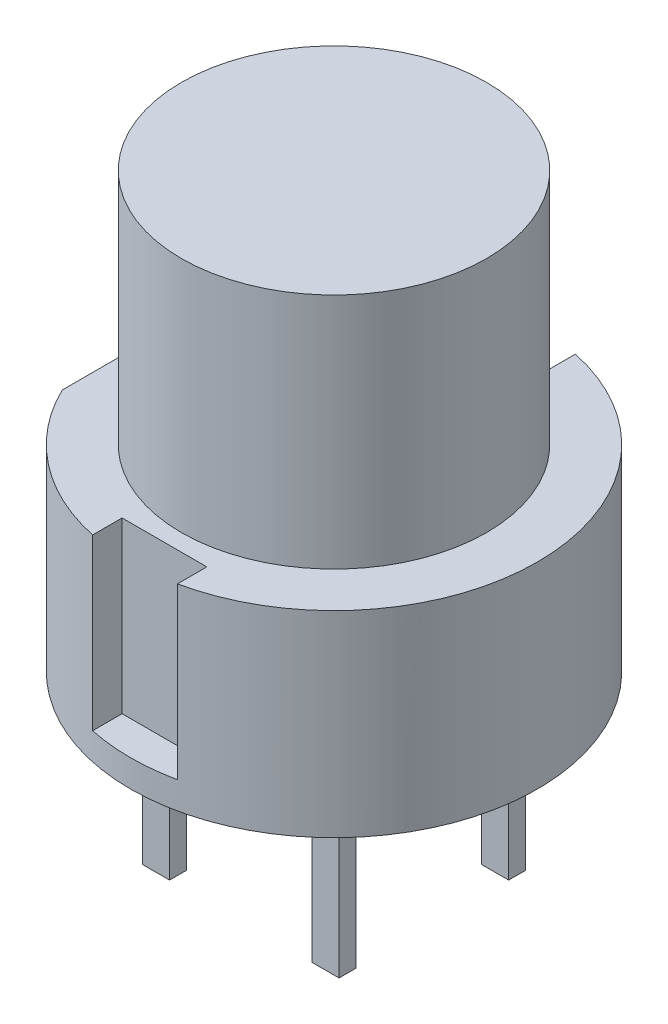
from build123d import *

# Parameters (mm, degrees)
SKETCH2_W      = 0.8
SKETCH2_H      = 0.5
LEGS_DEPTH     = 5
SKETCH3_W      = 4.6
SKETCH3_H      = 13.743650636
EXTRUDE3_DEPTH = 20.719026345
SKETCH4_W      = 2.5
SKETCH4_H      = 2
EXTRUDE4_DEPTH = 5


with BuildPart() as part:
    # Sketch1 → Revolve1 (revolve)
    with BuildSketch(Plane.XY, mode=Mode.PRIVATE) as revolve1_sk:
        Polygon((0, 0), (2, 0), (2, 1.5), (6, 1.5), (6, 7.3), (4.5, 7.3), (4.5, 14.3), (0, 14.3), align=None)
    revolve(revolve1_sk.sketch.rotate(Axis((0, 33.182896664, 0), (0, -1, 0)), 90), axis=Axis((0, 33.182896664, 0), (0, -1, 0)))

    # Sketch2 → Legs (add)
    with BuildSketch(Plane.XZ.offset(-1.5)):
        with Locations((-2.5, 2.5)):
            Rectangle(SKETCH2_W, SKETCH2_H)
        with Locations((2.5, 2.5)):
            Rectangle(SKETCH2_W, SKETCH2_H)
        with Locations((2.5, -2.5)):
            Rectangle(SKETCH2_W, SKETCH2_H)
        with Locations((-2.5, -2.5)):
            Rectangle(SKETCH2_W, SKETCH2_H)
    extrude(amount=LEGS_DEPTH)

    # Sketch3 → Extrude3 (cut, through all)
    with BuildSketch(Plane(origin=(0, 14.3, 0), x_dir=(1, 0, 0), z_dir=(0, 1, 0))):
        with Locations((-7.7, -0.438016034)):
            Rectangle(SKETCH3_W, SKETCH3_H)
    extrude(amount=-EXTRUDE3_DEPTH, mode=Mode.SUBTRACT)

    # Sketch4 → Extrude4 (cut)
    with BuildSketch(Plane(origin=(0, 7.3, 0), x_dir=(1, 0, 0), z_dir=(0, 1, 0))):
        with Locations((0, 6)):
            Rectangle(SKETCH4_W, SKETCH4_H)
        with Locations((0, -6)):
            Rectangle(SKETCH4_W, SKETCH4_H)
    extrude(amount=-EXTRUDE4_DEPTH, mode=Mode.SUBTRACT)


solid = part.part
